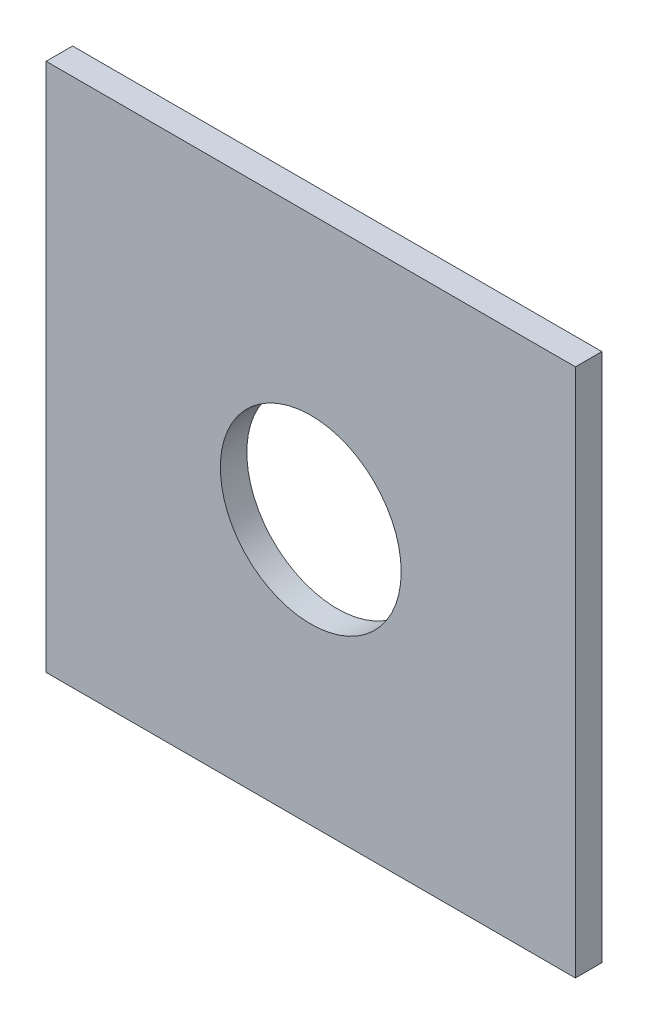
from build123d import *

# Parameters (mm, degrees)
SKETCH1_W           = 60
SKETCH1_H           = 60
BOSS_EXTRUDE1_DEPTH = 3
SKETCH2_R           = 10.25
CUT_EXTRUDE1_DEPTH  = 43.532340636


with BuildPart() as part:
    # Sketch1 → Boss-Extrude1 (new body)
    with BuildSketch(Plane.XY):
        Rectangle(SKETCH1_W, SKETCH1_H)
    extrude(amount=BOSS_EXTRUDE1_DEPTH)

    # Sketch2 → Cut-Extrude1 (cut, through all)
    with BuildSketch(Plane.XY.offset(3)):
        Circle(SKETCH2_R)
    extrude(amount=-CUT_EXTRUDE1_DEPTH, mode=Mode.SUBTRACT)


solid = part.part
